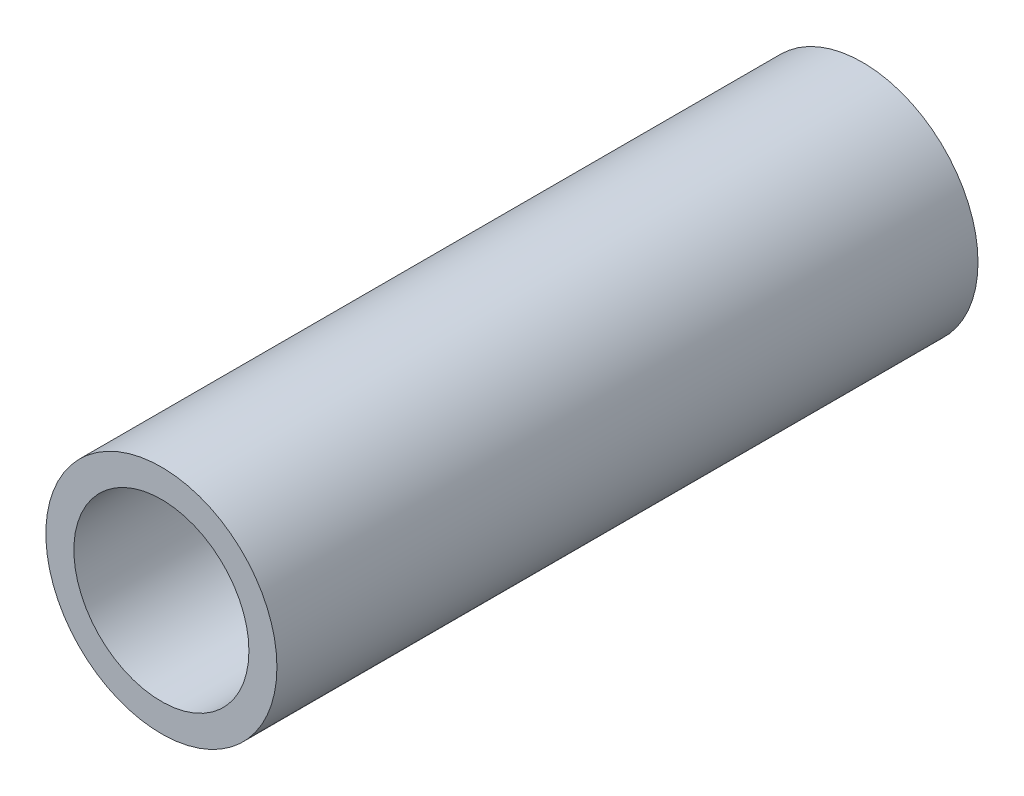
from build123d import *

# Parameters (mm, degrees)
SKETCH1_R           = 14.6685
SKETCH1_R_2         = 11.1125
BOSS_EXTRUDE1_DEPTH = 44.5


with BuildPart() as part:
    # Sketch1 → Boss-Extrude1 (new, symmetric)
    with BuildSketch(Plane.XY):
        Circle(SKETCH1_R)
        Circle(SKETCH1_R_2, mode=Mode.SUBTRACT)
    extrude(amount=BOSS_EXTRUDE1_DEPTH, both=True)


solid = part.part
